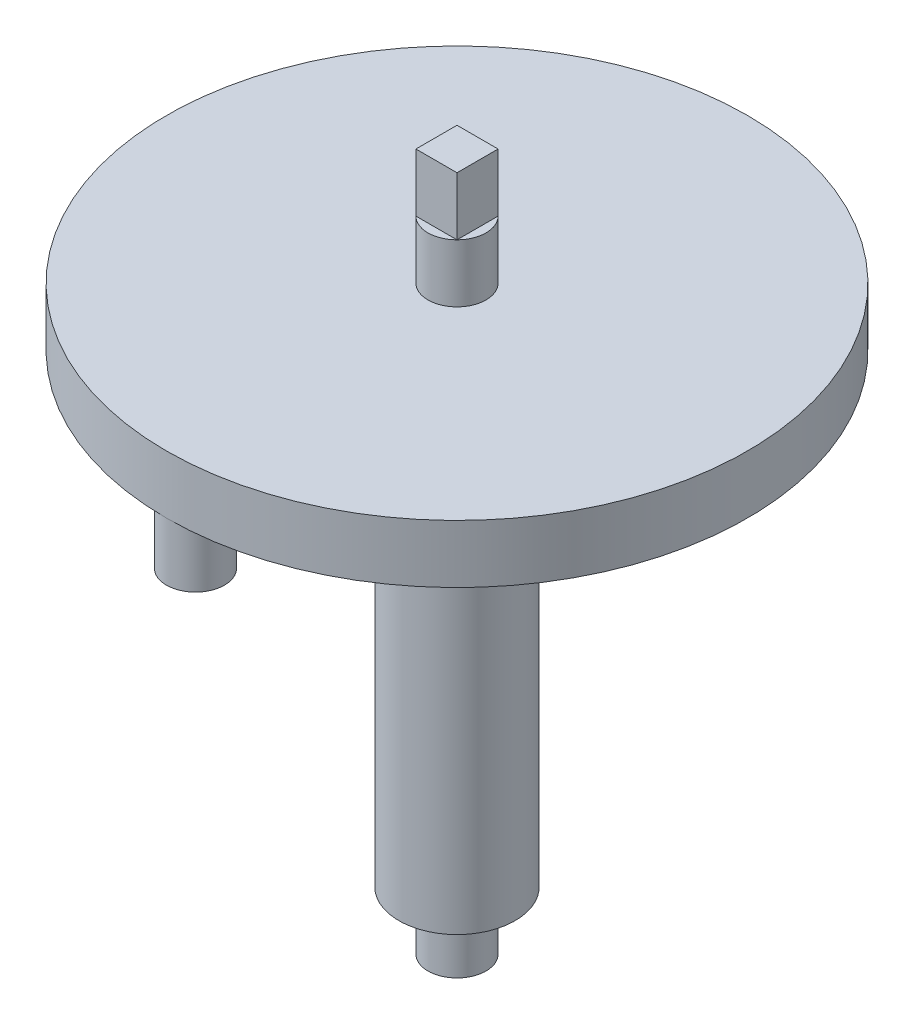
from build123d import *
from build123d.topology import SkipClean

# Parameters (mm, degrees)
SKETCH1_R           = 25
SKETCH1_R_2         = 2.5
BOSS_EXTRUDE1_DEPTH = 5
SKETCH2_R           = 2.5
BOSS_EXTRUDE2_DEPTH = 5
BOSS_EXTRUDE3_START = 5
SKETCH3_R           = 2.5
BOSS_EXTRUDE3_DEPTH = 5
BOSS_EXTRUDE4_START = 35
SKETCH4_R           = 5
SKETCH4_R_2         = 2.5
BOSS_EXTRUDE4_DEPTH = 35
BOSS_EXTRUDE5_START = -50
SKETCH5_R           = 2.5
BOSS_EXTRUDE5_DEPTH = 55
SKETCH6_W           = 3.535533906
SKETCH6_H           = 3.535533906
BOSS_EXTRUDE6_DEPTH = 5


with BuildPart() as part:
    # Sketch1 → Boss-Extrude1 (new body)
    with BuildSketch(Plane(origin=(0, 0, 0), x_dir=(1, 0, 0), z_dir=(0, 1, 0))):
        with Locations(Location((0, 0, 0), (0, 0, 270))):
            Circle(SKETCH1_R)
        with Locations(Location((0, 0, 0), (0, 0, 270))):
            Circle(SKETCH1_R_2, mode=Mode.SUBTRACT)
    extrude(amount=BOSS_EXTRUDE1_DEPTH)

    # Sketch2 → Boss-Extrude2 (add)
    with BuildSketch(Plane.XZ):
        with Locations(Location((0, 22.5, 0), (0, 0, 90))):
            Circle(SKETCH2_R)
    extrude(amount=BOSS_EXTRUDE2_DEPTH)

    # Sketch3 → Boss-Extrude3 (add)
    with SkipClean():  # the faces are left unmerged after this step: merging them gives an invalid solid
        with BuildSketch(Plane.XZ.offset(BOSS_EXTRUDE3_START)):
            with BuildLine():
                ThreePointArc((-12.29868157, 10.234375), (0, -16), (12.29868157, 10.234375))
                ThreePointArc((12.29868157, 10.234375), (0, 7), (-12.29868157, 10.234375))
            make_face()
            with Locations(Location((0, 0, 0), (0, 0, 270))):
                Circle(SKETCH3_R, mode=Mode.SUBTRACT)
        extrude(amount=-BOSS_EXTRUDE3_DEPTH)

    # Sketch4 → Boss-Extrude4 (add)
    with SkipClean():  # the faces are left unmerged after this step: merging them gives an invalid solid
        with BuildSketch(Plane.XZ.offset(5).offset(BOSS_EXTRUDE4_START)):
            with Locations(Location((0, 0, 0), (0, 0, 270))):
                Circle(SKETCH4_R)
            with Locations(Location((0, 0, 0), (0, 0, 270))):
                Circle(SKETCH4_R_2, mode=Mode.SUBTRACT)
        extrude(amount=-BOSS_EXTRUDE4_DEPTH)

    # Sketch5 → Boss-Extrude5 (add)
    with BuildSketch(Plane(origin=(0, 5, 0), x_dir=(1, 0, 0), z_dir=(0, 1, 0)).offset(BOSS_EXTRUDE5_START)):
        with Locations(Location((0, 0, 0), (0, 0, 90))):
            Circle(SKETCH5_R)
    extrude(amount=BOSS_EXTRUDE5_DEPTH)

    # Sketch6 → Boss-Extrude6 (add)
    with BuildSketch(Plane(origin=(0, 10, 0), x_dir=(1, 0, 0), z_dir=(0, 1, 0))):
        Rectangle(SKETCH6_W, SKETCH6_H)
    extrude(amount=BOSS_EXTRUDE6_DEPTH)


solid = part.part
